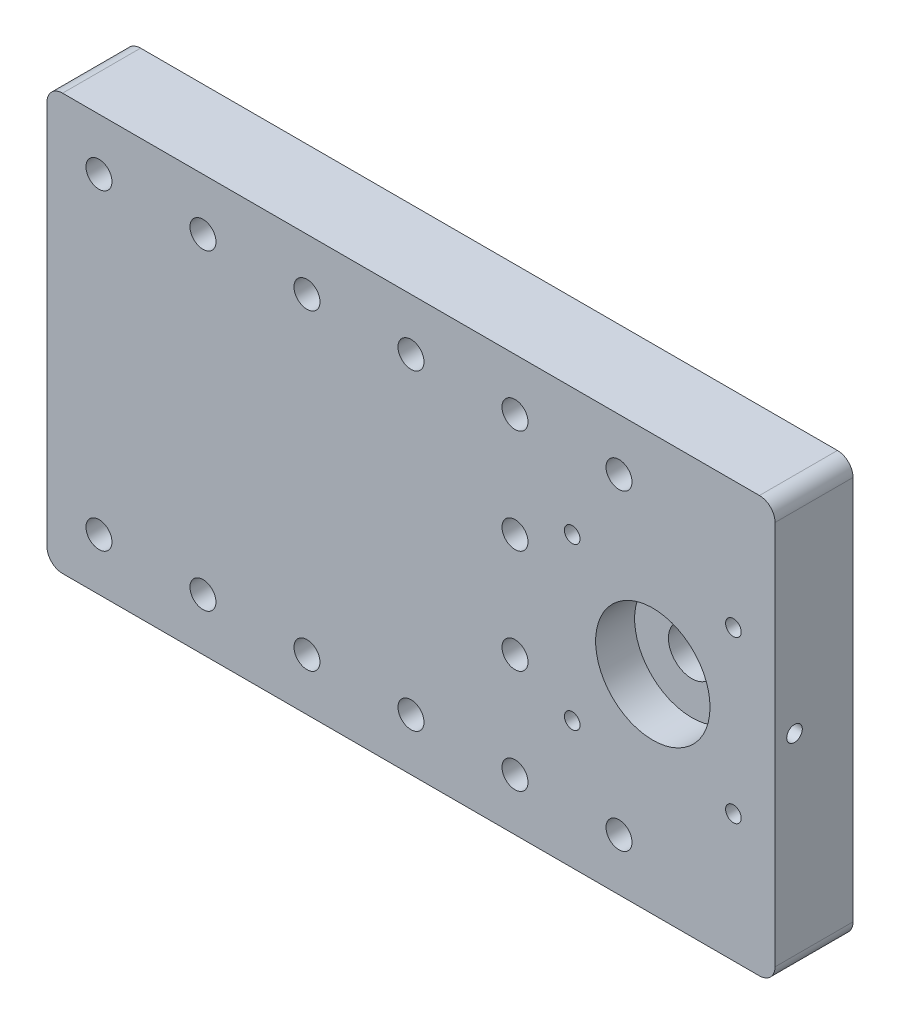
from build123d import *

# Parameters (mm, degrees)
SKETCH1_W               = 60
SKETCH1_H               = 80
SKETCH1_R               = 1.5
SKETCH1_R_2             = 11
SKETCH1_R_3             = 2.5
SKETCH1_W_2             = 80
BOSS_EXTRUDE1_DEPTH     = 15
SKETCH1_3_R             = 11
SKETCH1_3_R_2           = 4.5
BOSS_EXTRUDE2_DEPTH     = 7.5
FILLET1_R               = 3
CUT_EXTRUDE1_REACH      = 163.941
CUT_EXTRUDE1_END_RADIUS = 11
SKETCH2_R               = 1.5


with BuildPart() as part:
    # Sketch1 → Boss-Extrude1 (new body)
    # profile 1 of 2: a face of its own
    with BuildSketch(Plane.XY):
        with Locations((30, 40)):
            Rectangle(SKETCH1_W, SKETCH1_H)
        with Locations((21, 24.5)):
            Circle(SKETCH1_R, mode=Mode.SUBTRACT)
        with Locations((52, 24.5)):
            Circle(SKETCH1_R, mode=Mode.SUBTRACT)
        with Locations((52, 55.5)):
            Circle(SKETCH1_R, mode=Mode.SUBTRACT)
        with Locations((21, 55.5)):
            Circle(SKETCH1_R, mode=Mode.SUBTRACT)
        with Locations((36.5, 40)):
            Circle(SKETCH1_R_2, mode=Mode.SUBTRACT)
        with Locations((30, 10)):
            Circle(SKETCH1_R_3, mode=Mode.SUBTRACT)
        with Locations((30, 70)):
            Circle(SKETCH1_R_3, mode=Mode.SUBTRACT)
        with Locations((10, 70)):
            Circle(SKETCH1_R_3, mode=Mode.SUBTRACT)
        with Locations((10, 50)):
            Circle(SKETCH1_R_3, mode=Mode.SUBTRACT)
        with Locations((10, 30)):
            Circle(SKETCH1_R_3, mode=Mode.SUBTRACT)
        with Locations((10, 10)):
            Circle(SKETCH1_R_3, mode=Mode.SUBTRACT)
    # profile 2 of 2: a face of its own
    with BuildSketch(Plane.XY):
        with Locations((-40, 40)):
            Rectangle(SKETCH1_W_2, SKETCH1_H)
        with Locations((-10, 10)):
            Circle(SKETCH1_R_3, mode=Mode.SUBTRACT)
        with Locations((-30, 10)):
            Circle(SKETCH1_R_3, mode=Mode.SUBTRACT)
        with Locations((-50, 10)):
            Circle(SKETCH1_R_3, mode=Mode.SUBTRACT)
        with Locations((-70, 10)):
            Circle(SKETCH1_R_3, mode=Mode.SUBTRACT)
        with Locations((-10, 70)):
            Circle(SKETCH1_R_3, mode=Mode.SUBTRACT)
        with Locations((-30, 70)):
            Circle(SKETCH1_R_3, mode=Mode.SUBTRACT)
        with Locations((-50, 70)):
            Circle(SKETCH1_R_3, mode=Mode.SUBTRACT)
        with Locations((-70, 70)):
            Circle(SKETCH1_R_3, mode=Mode.SUBTRACT)
    extrude(amount=BOSS_EXTRUDE1_DEPTH)

    # Sketch1<3> → Boss-Extrude2 (add)
    with BuildSketch(Plane.XY):
        with Locations((36.5, 40)):
            Circle(SKETCH1_3_R)
        with Locations((36.5, 40)):
            Circle(SKETCH1_3_R_2, mode=Mode.SUBTRACT)
    extrude(amount=BOSS_EXTRUDE2_DEPTH)

    # Fillet1
    fillet1_edges = [part.edges().sort_by_distance(p)[0] for p in [
        (-80, 0, 7.5),
        (-80, 80, 7.5),
        (60, 80, 7.5),
        (60, 0, 7.5),
    ]]
    fillet(fillet1_edges, radius=FILLET1_R)

    # Cut-Extrude1: up to this cylinder (the profile starts outside it)
    cut_extrude1_end = Plane(origin=(36.5, 40, 11.25), z_dir=(0, 0, -1)) * Cylinder(CUT_EXTRUDE1_END_RADIUS, 350.882, mode=Mode.PRIVATE)
    # Sketch2 → Cut-Extrude1 (cut, up to the surface)
    with BuildSketch(Plane(origin=(60, 0, 0), x_dir=(0, 0, -1), z_dir=(1, 0, 0)), mode=Mode.PRIVATE) as cut_extrude1_sk1:
        with Locations((-11.25, 40)):
            Circle(SKETCH2_R)
    cut_extrude1_tool1 = extrude(cut_extrude1_sk1.sketch, amount=-CUT_EXTRUDE1_REACH, mode=Mode.PRIVATE) - cut_extrude1_end
    add(cut_extrude1_tool1.solids().sort_by_distance((60, 40, 11.25))[0], mode=Mode.SUBTRACT)


solid = part.part
